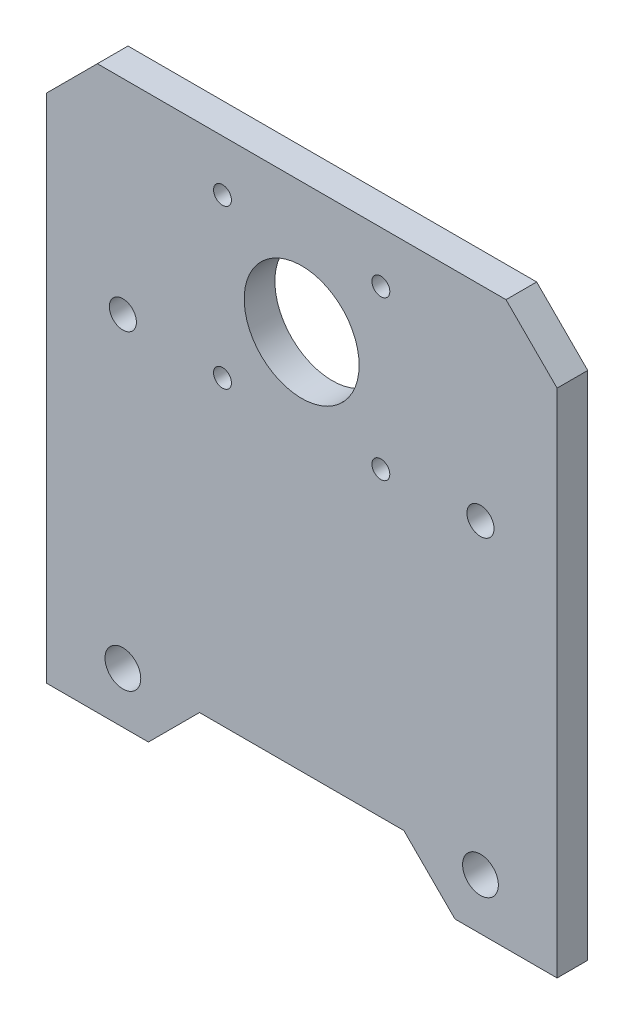
from build123d import *

# Parameters (mm, degrees)
CROQUIS1_R              = 2.65
CROQUIS1_R_2            = 3.5
CROQUIS1_R_3            = 1.75
CROQUIS1_R_4            = 11.25
SALIENTE_EXTRUIR1_DEPTH = 6


with BuildPart() as part:
    # Croquis1 → Saliente-Extruir1 (new body)
    with BuildSketch(Plane.XY):
        Polygon((100, 100), (100, 0), (80, 0), (70, 10), (30, 10), (20, 0), (0, 0), (0, 100), (10, 110), (90, 110), align=None)
        with Locations((15, 70)):
            Circle(CROQUIS1_R, mode=Mode.SUBTRACT)
        with Locations((15, 10)):
            Circle(CROQUIS1_R_2, mode=Mode.SUBTRACT)
        with Locations((85, 10)):
            Circle(CROQUIS1_R_2, mode=Mode.SUBTRACT)
        with Locations((34.5, 100)):
            Circle(CROQUIS1_R_3, mode=Mode.SUBTRACT)
        with Locations((65.5, 100)):
            Circle(CROQUIS1_R_3, mode=Mode.SUBTRACT)
        with Locations((65.5, 69)):
            Circle(CROQUIS1_R_3, mode=Mode.SUBTRACT)
        with Locations((34.5, 69)):
            Circle(CROQUIS1_R_3, mode=Mode.SUBTRACT)
        with Locations((50, 84.5)):
            Circle(CROQUIS1_R_4, mode=Mode.SUBTRACT)
        with Locations((85, 70)):
            Circle(CROQUIS1_R, mode=Mode.SUBTRACT)
    extrude(amount=SALIENTE_EXTRUIR1_DEPTH)


solid = part.part
